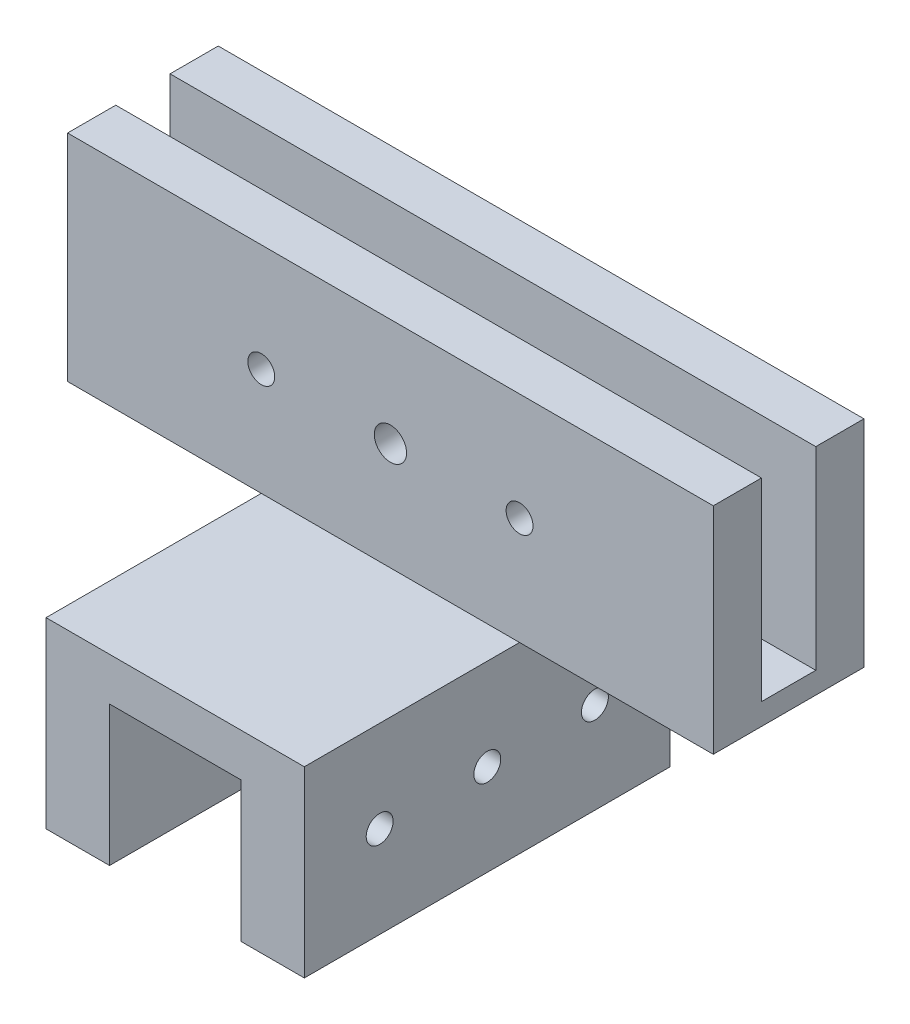
from build123d import *

# Parameters (mm, degrees)
BOSS_EXTRUDE1_DEPTH          = 10
BOSS_EXTRUDE1_DEPTH_BACK     = 7
SKETCH1_W                    = 12
SKETCH1_H                    = 2
SKETCH1_W_2                  = 2.95
SKETCH1_H_2                  = 6.5
SKETCH1_3_W                  = 30
SKETCH1_3_H                  = 10
BOSS_EXTRUDE2_DEPTH          = 7
SKETCH3_W                    = 2.52297433
SKETCH3_H                    = 9
CUT_EXTRUDE1_DEPTH           = 34.823069051
M1_6X0_35_TAPPED_HOLE1_D     = 1.25
M1_6X0_35_TAPPED_HOLE1_DEPTH = 2.238512835
M1_6X0_35_TAPPED_HOLE2_D     = 1.25
M1_6X0_35_TAPPED_HOLE2_DEPTH = 2.95
F_1_5MM_DOWEL_HOLE1_D        = 1.5


with BuildPart() as part:
    # Sketch1 → Boss-Extrude1 (new, two sides: drawn at the far end of the back side and taken through both)
    with BuildSketch(Plane.XY.offset(-BOSS_EXTRUDE1_DEPTH_BACK)):
        with Locations((0, 1)):
            Rectangle(SKETCH1_W, SKETCH1_H)
        with Locations((4.525, -3.25)):
            Rectangle(SKETCH1_W_2, SKETCH1_H_2)
        with Locations((-4.525, -3.25)):
            Rectangle(SKETCH1_W_2, SKETCH1_H_2)
    extrude(amount=BOSS_EXTRUDE1_DEPTH + BOSS_EXTRUDE1_DEPTH_BACK)

    # Sketch1<3> → Boss-Extrude2 (add)
    with BuildSketch(Plane.XY):
        with Locations((0, 7)):
            Rectangle(SKETCH1_3_W, SKETCH1_3_H)
    extrude(amount=-BOSS_EXTRUDE2_DEPTH)

    # Sketch3 → Cut-Extrude1 (cut, through all)
    with BuildSketch(Plane.ZY.offset(15)):
        with Locations((-3.5, 7.5)):
            Rectangle(SKETCH3_W, SKETCH3_H)
    extrude(amount=-CUT_EXTRUDE1_DEPTH, mode=Mode.SUBTRACT)

    # M1.6x0.35 Tapped Hole1
    with Locations(Plane.XY):
        with Locations((6, 7), (-6, 7)):
            Hole(M1_6X0_35_TAPPED_HOLE1_D / 2, depth=M1_6X0_35_TAPPED_HOLE1_DEPTH)

    # M1.6x0.35 Tapped Hole2
    with Locations(Plane(origin=(6, 0, 0), x_dir=(0, 0, -1), z_dir=(1, 0, 0))):
        with Locations((3.5, -2.25), (-6.5, -2.25), (-1.5, -2.25)):
            Hole(M1_6X0_35_TAPPED_HOLE2_D / 2, depth=M1_6X0_35_TAPPED_HOLE2_DEPTH)

    # Ø1.5mm Dowel Hole1 (through all)
    with Locations(Plane.XY):
        with Locations((0, 7)):
            Hole(F_1_5MM_DOWEL_HOLE1_D / 2)


solid = part.part
